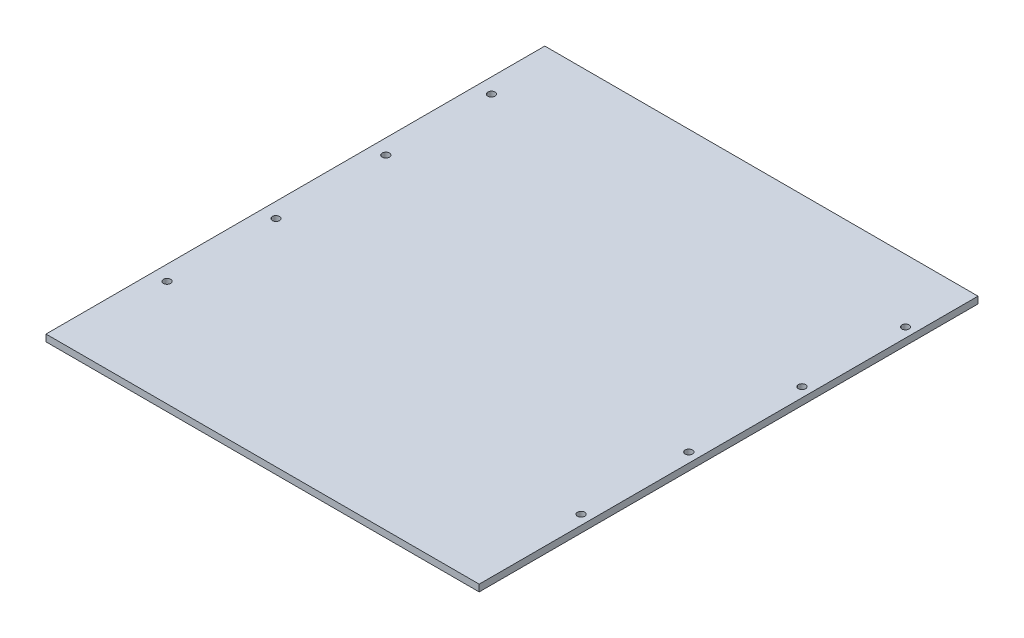
from build123d import *

# Parameters (mm, degrees)
SKETCH1_W           = 203
SKETCH1_H           = 238
BOSS_EXTRUDE1_DEPTH = 3.175
SKETCH2_R           = 1.7
CUT_EXTRUDE1_DEPTH  = 313.830753963
SKETCH3_R           = 1.7
CUT_EXTRUDE2_DEPTH  = 313.830753963
SKETCH4_W           = 203
SKETCH4_H           = 4.25
CUT_EXTRUDE3_DEPTH  = 313.830753963


with BuildPart() as part:
    # Sketch1 → Boss-Extrude1 (new body)
    with BuildSketch(Plane(origin=(0, 0, 0), x_dir=(1, 0, 0), z_dir=(0, 1, 0))):
        with Locations((101.5, 119)):
            Rectangle(SKETCH1_W, SKETCH1_H)
    extrude(amount=BOSS_EXTRUDE1_DEPTH)

    # Sketch2 → Cut-Extrude1 (cut, through all)
    with BuildSketch(Plane(origin=(0, 3.175, 0), x_dir=(1, 0, 0), z_dir=(0, 1, 0))):
        with Locations(Location((7, 206, 0), (0, 0, 270))):
            Circle(SKETCH2_R)
        with Locations(Location((7, 156.5, 0), (0, 0, 270))):
            Circle(SKETCH2_R)
        with Locations(Location((7, 105, 0), (0, 0, 270))):
            Circle(SKETCH2_R)
        with Locations(Location((7, 54, 0), (0, 0, 270))):
            Circle(SKETCH2_R)
    extrude(amount=-CUT_EXTRUDE1_DEPTH, mode=Mode.SUBTRACT)

    # Sketch3 → Cut-Extrude2 (cut, through all)
    with BuildSketch(Plane(origin=(0, 3.175, 0), x_dir=(1, 0, 0), z_dir=(0, 1, 0))):
        with Locations(Location((198.5, 208.5, 0), (0, 0, 270))):
            Circle(SKETCH3_R)
        with Locations(Location((198.5, 160, 0), (0, 0, 270))):
            Circle(SKETCH3_R)
        with Locations(Location((198.5, 107, 0), (0, 0, 270))):
            Circle(SKETCH3_R)
        with Locations(Location((198.5, 56.5, 0), (0, 0, 270))):
            Circle(SKETCH3_R)
    extrude(amount=-CUT_EXTRUDE2_DEPTH, mode=Mode.SUBTRACT)

    # Sketch4 → Cut-Extrude3 (cut, through all)
    with BuildSketch(Plane(origin=(0, 3.175, 0), x_dir=(1, 0, 0), z_dir=(0, 1, 0))):
        with Locations((101.5, 2.125)):
            Rectangle(SKETCH4_W, SKETCH4_H)
    extrude(amount=-CUT_EXTRUDE3_DEPTH, mode=Mode.SUBTRACT)


solid = part.part
